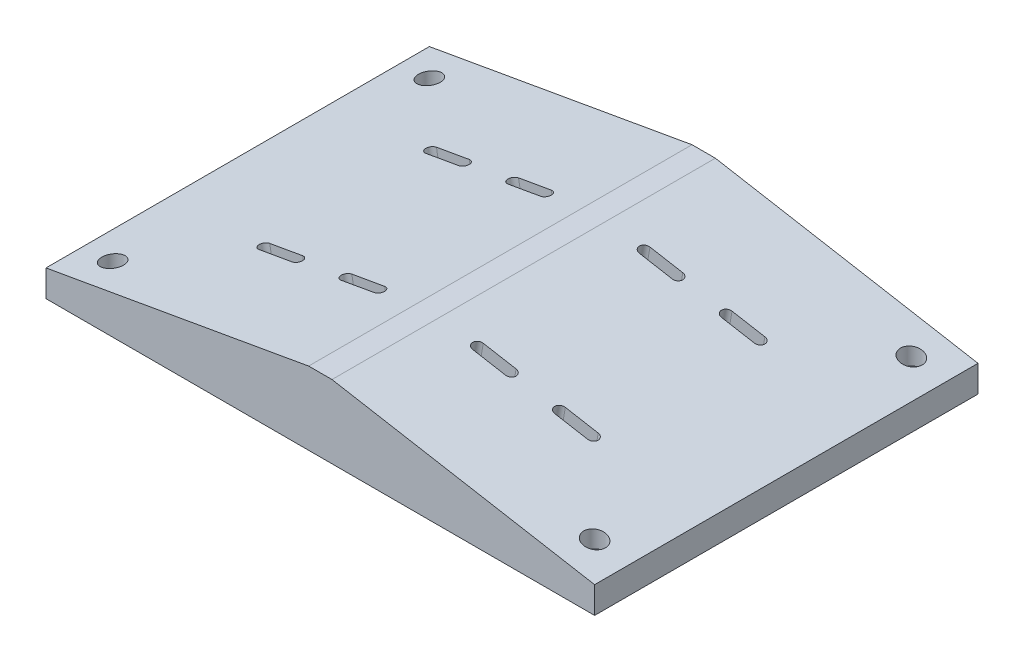
from build123d import *

# Parameters (mm, degrees)
BOSS_EXTRUDE1_DEPTH           = 57.5
CUT_EXTRUDE1_DEPTH            = 7
CUT_EXTRUDE4_START            = -7
CUT_EXTRUDE4_DEPTH            = 99.838825225
CBORE_FOR_M3_SHCS1_AT_2_COUNT = 2
CBORE_FOR_M3_SHCS1_AT_2_PITCH = 95
CBORE_FOR_M3_SHCS1_AT_3_COUNT = 2
CBORE_FOR_M3_SHCS1_AT_3_PITCH = 144.569240482
CBORE_FOR_M3_SHCS1_AT_4_COUNT = 2
CBORE_FOR_M3_SHCS1_AT_4_PITCH = 172.989205714
SKETCH14_R                    = 3.25
CUT_EXTRUDE5_DEPTH            = 102.795596501


with BuildPart() as part:
    # Sketch1 → Boss-Extrude1 (new, symmetric)
    with BuildSketch(Plane.XY):
        Polygon((-82.284620241, 0), (82.284620241, 0), (82.284620241, 8), (3.5, 21.891854213), (-3.5, 21.891854213), (-82.284620241, 8), align=None)
    extrude(amount=BOSS_EXTRUDE1_DEPTH, both=True)

    # Sketch2 → Cut-Extrude1 (cut)
    with BuildSketch(Plane(origin=(-3.849265471, 21.830269287, 0), x_dir=(0.9848077530122079, 0.17364817766693139, 0), z_dir=(-0.17364817766693139, 0.9848077530122079, 0))):
        with BuildLine():
            Line((-46.110814579, 26.6), (-36.110814579, 26.6))
            ThreePointArc((-36.110814579, 26.6), (-34.510814579, 25), (-36.110814579, 23.4))
            Line((-36.110814579, 23.4), (-46.110814579, 23.4))
            ThreePointArc((-46.110814579, 23.4), (-47.710814579, 25), (-46.110814579, 26.6))
        make_face()
        with BuildLine():
            Line((-11.110814579, -26.6), (-21.110814579, -26.6))
            ThreePointArc((-21.110814579, -26.6), (-22.710814579, -25), (-21.110814579, -23.4))
            Line((-21.110814579, -23.4), (-11.110814579, -23.4))
            ThreePointArc((-11.110814579, -23.4), (-9.510814579, -25), (-11.110814579, -26.6))
        make_face()
        with BuildLine():
            Line((-11.110814579, 26.6), (-21.110814579, 26.6))
            ThreePointArc((-21.110814579, 26.6), (-22.710814579, 25), (-21.110814579, 23.4))
            Line((-21.110814579, 23.4), (-11.110814579, 23.4))
            ThreePointArc((-11.110814579, 23.4), (-9.510814579, 25), (-11.110814579, 26.6))
        make_face()
        with BuildLine():
            Line((-46.110814579, -26.6), (-36.110814579, -26.6))
            ThreePointArc((-36.110814579, -26.6), (-34.510814579, -25), (-36.110814579, -23.4))
            Line((-36.110814579, -23.4), (-46.110814579, -23.4))
            ThreePointArc((-46.110814579, -23.4), (-47.710814579, -25), (-46.110814579, -26.6))
        make_face()
    cut_extrude1 = extrude(amount=-CUT_EXTRUDE1_DEPTH, mode=Mode.SUBTRACT)

    # Sketch7 → Cut-Extrude4 (cut, through all)
    # profile 1 of 10: a face of its own
    with BuildSketch(Plane(origin=(-3.849265471, 21.830269287, 0), x_dir=(0.9848077530122079, 0.1736481776669313, 0), z_dir=(-0.1736481776669313, 0.9848077530122079, 0)).offset(CUT_EXTRUDE4_START)):
        with BuildLine():
            ThreePointArc((-32.360814579, 22.125), (-30.327882583, 22.967068004), (-29.485814579, 25))
            Line((-29.485814579, 25), (-34.510814579, 25))
            ThreePointArc((-34.510814579, 25), (-34.979443729, 23.86862915), (-36.110814579, 23.4))
            Line((-36.110814579, 23.4), (-41.110814579, 23.4))
            Line((-41.110814579, 23.4), (-41.110814579, 22.125))
            Line((-41.110814579, 22.125), (-32.360814579, 22.125))
        make_face()
    # profile 2 of 10: a face of its own
    with BuildSketch(Plane(origin=(-3.849265471, 21.830269287, 0), x_dir=(0.9848077530122079, 0.1736481776669313, 0), z_dir=(-0.1736481776669313, 0.9848077530122079, 0)).offset(CUT_EXTRUDE4_START)):
        with BuildLine():
            Line((-32.360814579, 27.875), (-49.860814579, 27.875))
            ThreePointArc((-49.860814579, 27.875), (-52.735814579, 25), (-49.860814579, 22.125))
            Line((-49.860814579, 22.125), (-41.110814579, 22.125))
            Line((-41.110814579, 22.125), (-41.110814579, 23.4))
            Line((-41.110814579, 23.4), (-46.110814579, 23.4))
            ThreePointArc((-46.110814579, 23.4), (-47.710814579, 25), (-46.110814579, 26.6))
            Line((-46.110814579, 26.6), (-36.110814579, 26.6))
            ThreePointArc((-36.110814579, 26.6), (-34.979443729, 26.13137085), (-34.510814579, 25))
            Line((-34.510814579, 25), (-29.485814579, 25))
            ThreePointArc((-29.485814579, 25), (-30.327882583, 27.032931996), (-32.360814579, 27.875))
        make_face()
    # profile 3 of 10: a face of its own
    with BuildSketch(Plane(origin=(-3.849265471, 21.830269287, 0), x_dir=(0.9848077530122079, 0.1736481776669313, 0), z_dir=(-0.1736481776669313, 0.9848077530122079, 0)).offset(CUT_EXTRUDE4_START)):
        with BuildLine():
            ThreePointArc((-36.110814579, 23.4), (-34.979443729, 23.86862915), (-34.510814579, 25))
            Line((-34.510814579, 25), (-41.110814579, 25))
            Line((-41.110814579, 25), (-41.110814579, 23.4))
            Line((-41.110814579, 23.4), (-36.110814579, 23.4))
        make_face()
    # profile 4 of 10: a face of its own
    with BuildSketch(Plane(origin=(-3.849265471, 21.830269287, 0), x_dir=(0.9848077530122079, 0.1736481776669313, 0), z_dir=(-0.1736481776669313, 0.9848077530122079, 0)).offset(CUT_EXTRUDE4_START)):
        with BuildLine():
            Line((-41.110814579, 25), (-34.510814579, 25))
            ThreePointArc((-34.510814579, 25), (-34.979443729, 26.13137085), (-36.110814579, 26.6))
            Line((-36.110814579, 26.6), (-46.110814579, 26.6))
            ThreePointArc((-46.110814579, 26.6), (-47.710814579, 25), (-46.110814579, 23.4))
            Line((-46.110814579, 23.4), (-41.110814579, 23.4))
            Line((-41.110814579, 23.4), (-41.110814579, 25))
        make_face()
    # profile 5 of 10: a face of its own
    with BuildSketch(Plane(origin=(-3.849265471, 21.830269287, 0), x_dir=(0.9848077530122079, 0.1736481776669313, 0), z_dir=(-0.1736481776669313, 0.9848077530122079, 0)).offset(CUT_EXTRUDE4_START)):
        with BuildLine():
            ThreePointArc((-24.860814579, 22.125), (-27.735814579, 25), (-24.860814579, 27.875))
            Line((-24.860814579, 27.875), (-7.360814579, 27.875))
            ThreePointArc((-7.360814579, 27.875), (-4.485814579, 25), (-7.360814579, 22.125))
            Line((-7.360814579, 22.125), (-24.860814579, 22.125))
        make_face()
        with BuildLine():
            ThreePointArc((-11.110814579, 26.6), (-9.510814579, 25), (-11.110814579, 23.4))
            Line((-11.110814579, 23.4), (-21.110814579, 23.4))
            ThreePointArc((-21.110814579, 23.4), (-22.710814579, 25), (-21.110814579, 26.6))
            Line((-21.110814579, 26.6), (-11.110814579, 26.6))
        make_face(mode=Mode.SUBTRACT)
    # profile 6 of 10: a face of its own
    with BuildSketch(Plane(origin=(-3.849265471, 21.830269287, 0), x_dir=(0.9848077530122079, 0.1736481776669313, 0), z_dir=(-0.1736481776669313, 0.9848077530122079, 0)).offset(CUT_EXTRUDE4_START)):
        with BuildLine():
            Line((-11.110814579, 23.4), (-21.110814579, 23.4))
            ThreePointArc((-21.110814579, 23.4), (-22.710814579, 25), (-21.110814579, 26.6))
            Line((-21.110814579, 26.6), (-11.110814579, 26.6))
            ThreePointArc((-11.110814579, 26.6), (-9.510814579, 25), (-11.110814579, 23.4))
        make_face()
    # profile 7 of 10: a face of its own
    with BuildSketch(Plane(origin=(-3.849265471, 21.830269287, 0), x_dir=(0.9848077530122079, 0.1736481776669313, 0), z_dir=(-0.1736481776669313, 0.9848077530122079, 0)).offset(CUT_EXTRUDE4_START)):
        with BuildLine():
            ThreePointArc((-32.360814579, -22.125), (-29.485814579, -25), (-32.360814579, -27.875))
            Line((-32.360814579, -27.875), (-49.860814579, -27.875))
            ThreePointArc((-49.860814579, -27.875), (-52.735814579, -25), (-49.860814579, -22.125))
            Line((-49.860814579, -22.125), (-32.360814579, -22.125))
        make_face()
        with BuildLine():
            ThreePointArc((-46.110814579, -26.6), (-47.710814579, -25), (-46.110814579, -23.4))
            Line((-46.110814579, -23.4), (-36.110814579, -23.4))
            ThreePointArc((-36.110814579, -23.4), (-34.510814579, -25), (-36.110814579, -26.6))
            Line((-36.110814579, -26.6), (-46.110814579, -26.6))
        make_face(mode=Mode.SUBTRACT)
    # profile 8 of 10: a face of its own
    with BuildSketch(Plane(origin=(-3.849265471, 21.830269287, 0), x_dir=(0.9848077530122079, 0.1736481776669313, 0), z_dir=(-0.1736481776669313, 0.9848077530122079, 0)).offset(CUT_EXTRUDE4_START)):
        with BuildLine():
            Line((-46.110814579, -23.4), (-36.110814579, -23.4))
            ThreePointArc((-36.110814579, -23.4), (-34.510814579, -25), (-36.110814579, -26.6))
            Line((-36.110814579, -26.6), (-46.110814579, -26.6))
            ThreePointArc((-46.110814579, -26.6), (-47.710814579, -25), (-46.110814579, -23.4))
        make_face()
    # profile 9 of 10: a face of its own
    with BuildSketch(Plane(origin=(-3.849265471, 21.830269287, 0), x_dir=(0.9848077530122079, 0.1736481776669313, 0), z_dir=(-0.1736481776669313, 0.9848077530122079, 0)).offset(CUT_EXTRUDE4_START)):
        with BuildLine():
            Line((-7.360814579, -22.125), (-24.860814579, -22.125))
            ThreePointArc((-24.860814579, -22.125), (-27.735814579, -25), (-24.860814579, -27.875))
            Line((-24.860814579, -27.875), (-7.360814579, -27.875))
            ThreePointArc((-7.360814579, -27.875), (-4.485814579, -25), (-7.360814579, -22.125))
        make_face()
        with BuildLine():
            ThreePointArc((-21.110814579, -26.6), (-22.710814579, -25), (-21.110814579, -23.4))
            Line((-21.110814579, -23.4), (-11.110814579, -23.4))
            ThreePointArc((-11.110814579, -23.4), (-9.510814579, -25), (-11.110814579, -26.6))
            Line((-11.110814579, -26.6), (-21.110814579, -26.6))
        make_face(mode=Mode.SUBTRACT)
    # profile 10 of 10: a face of its own
    with BuildSketch(Plane(origin=(-3.849265471, 21.830269287, 0), x_dir=(0.9848077530122079, 0.1736481776669313, 0), z_dir=(-0.1736481776669313, 0.9848077530122079, 0)).offset(CUT_EXTRUDE4_START)):
        with BuildLine():
            Line((-21.110814579, -23.4), (-11.110814579, -23.4))
            ThreePointArc((-11.110814579, -23.4), (-9.510814579, -25), (-11.110814579, -26.6))
            Line((-11.110814579, -26.6), (-21.110814579, -26.6))
            ThreePointArc((-21.110814579, -26.6), (-22.710814579, -25), (-21.110814579, -23.4))
        make_face()
    cut_extrude4 = extrude(amount=-CUT_EXTRUDE4_DEPTH, mode=Mode.SUBTRACT)

    # Mirror1: Cut-Extrude1, Cut-Extrude4 across plane
    add(cut_extrude1.mirror(Plane(origin=(0, 0, 0), x_dir=(0, 0, 1), z_dir=(1, 0, 0))), mode=Mode.SUBTRACT)
    add(cut_extrude4.mirror(Plane(origin=(0, 0, 0), x_dir=(0, 0, 1), z_dir=(1, 0, 0))), mode=Mode.SUBTRACT)

    # Sketch12 → CBORE for M3 SHCS1 (revolve, cut)
    with BuildSketch(Plane(origin=(72.284620241, 8, -47.5), x_dir=(0, 0, 1), z_dir=(1, 0, 0))):
        Polygon((0, 0), (0, 8), (1.8, 8), (1.8, 3), (3.25, 3), (3.25, 0), align=None)
    cbore_for_m3_shcs1 = revolve(axis=Axis((72.284620241, 14.35, -47.5), (0, -1, 0)), mode=Mode.SUBTRACT)

    # CBORE for M3 SHCS1 at 2: CBORE for M3 SHCS1 ×2
    with Locations(*[(0, 0, i * CBORE_FOR_M3_SHCS1_AT_2_PITCH) for i in range(1, CBORE_FOR_M3_SHCS1_AT_2_COUNT)]):
        add(cbore_for_m3_shcs1, mode=Mode.SUBTRACT)

    # CBORE for M3 SHCS1 at 3: CBORE for M3 SHCS1 ×2
    with Locations(*[(-i * CBORE_FOR_M3_SHCS1_AT_3_PITCH, 0, 0) for i in range(1, CBORE_FOR_M3_SHCS1_AT_3_COUNT)]):
        add(cbore_for_m3_shcs1, mode=Mode.SUBTRACT)

    # CBORE for M3 SHCS1 at 4: CBORE for M3 SHCS1 ×2
    with Locations(*[Vector(-0.8357124936514465, 0, 0.5491672131098877) * (i * CBORE_FOR_M3_SHCS1_AT_4_PITCH) for i in range(1, CBORE_FOR_M3_SHCS1_AT_4_COUNT)]):
        add(cbore_for_m3_shcs1, mode=Mode.SUBTRACT)

    # Sketch14 → Cut-Extrude5 (cut, through all)
    with BuildSketch(Plane(origin=(0, 5, 0), x_dir=(1, 0, 0), z_dir=(0, 1, 0))):
        with Locations(Location((-72.284620241, -47.5, 0), (0, 0, 270))):
            Circle(SKETCH14_R)
        with Locations(Location((-72.284620241, 47.5, 0), (0, 0, 270))):
            Circle(SKETCH14_R)
        with Locations(Location((72.284620241, -47.5, 0), (0, 0, 270))):
            Circle(SKETCH14_R)
        with Locations(Location((72.284620241, 47.5, 0), (0, 0, 270))):
            Circle(SKETCH14_R)
    extrude(amount=CUT_EXTRUDE5_DEPTH, mode=Mode.SUBTRACT)


solid = part.part
